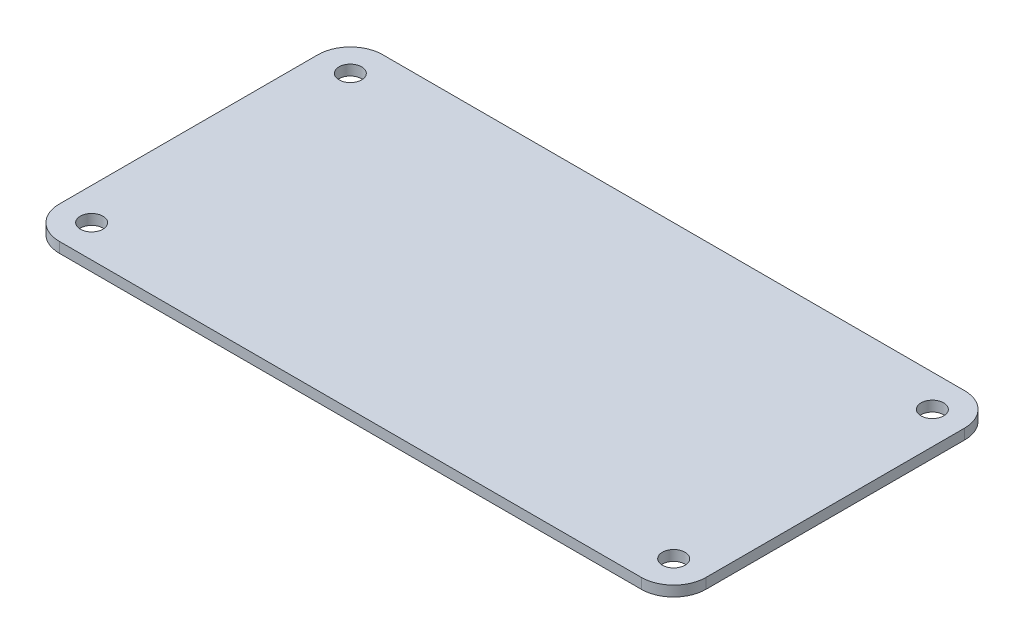
from build123d import *

# Parameters (mm, degrees)
SKETCH_1_W      = 100
SKETCH_1_H      = 50
SKETCH_1_R      = 1.75
EXTRUDE_1_DEPTH = 1.6
FILLET_1_R      = 5


with BuildPart() as part:
    # 草图1 → 凸台-拉伸1 (new body)
    with BuildSketch(Plane(origin=(0, 0, 0), x_dir=(1, 0, 0), z_dir=(0, 1, 0))):
        Rectangle(SKETCH_1_W, SKETCH_1_H)
        with Locations(Location((-45, 20, 0), (0, 0, 270))):
            Circle(SKETCH_1_R, mode=Mode.SUBTRACT)
        with Locations(Location((45, 20, 0), (0, 0, 270))):
            Circle(SKETCH_1_R, mode=Mode.SUBTRACT)
        with Locations(Location((45, -20, 0), (0, 0, 270))):
            Circle(SKETCH_1_R, mode=Mode.SUBTRACT)
        with Locations(Location((-45, -20, 0), (0, 0, 270))):
            Circle(SKETCH_1_R, mode=Mode.SUBTRACT)
    extrude(amount=EXTRUDE_1_DEPTH)

    # 圆角1
    fillet_1_edges = [part.edges().sort_by_distance(p)[0] for p in [
        (50, 0.8, 25),
        (-50, 0.8, 25),
        (-50, 0.8, -25),
        (50, 0.8, -25),
    ]]
    fillet(fillet_1_edges, radius=FILLET_1_R)


solid = part.part
